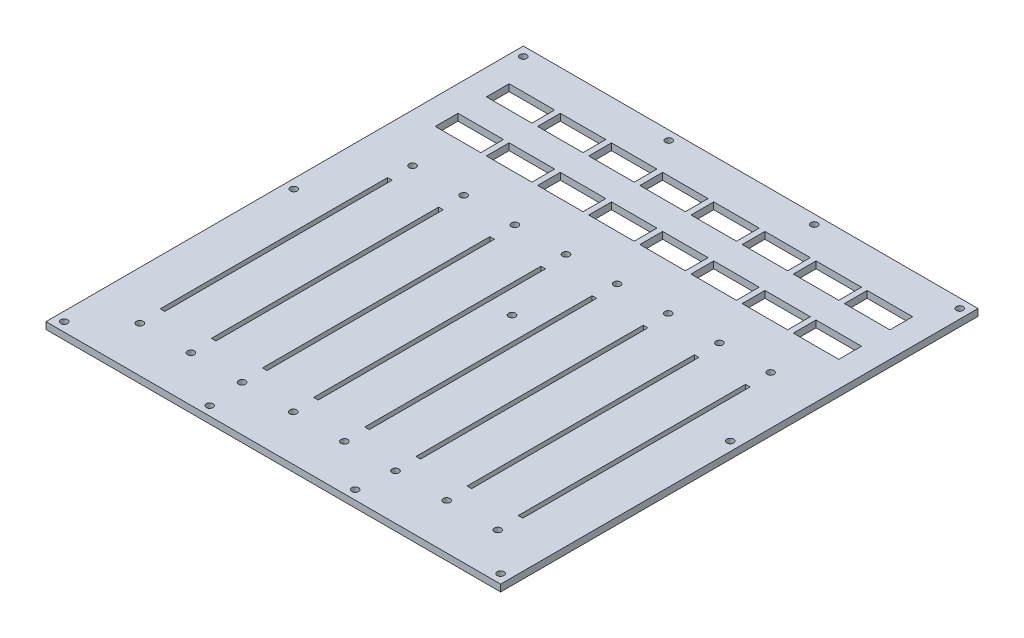
from build123d import *

# Parameters (mm, degrees)
SKETCH1_W                 = 200
SKETCH1_H                 = 210
BOSS_EXTRUDE1_DEPTH       = 3
CUT_EXTRUDE1_REACH        = 147.031
SKETCH2_R                 = 1.5
SKETCH2_W                 = 2
SKETCH2_H                 = 100
LPATTERN1_COUNT           = 8
LPATTERN1_PITCH           = 22.5
CUT_EXTRUDE2_REACH        = 147.031
SKETCH3_W                 = 20
SKETCH3_H                 = 10
LPATTERN2_COUNT           = 8
LPATTERN2_PITCH           = 22.5
LPATTERN2_COUNT_DIR2      = 2
LPATTERN2_PITCH_DIR2      = 22.5
CUT_EXTRUDE3_REACH        = 147.031
SKETCH4_R                 = 1.5
LPATTERN3_COUNT           = 4
LPATTERN3_PITCH           = 64
LPATTERN4_COUNT           = 2
LPATTERN4_PITCH           = 202
LPATTERN4_COPY_1_REACH    = 147.031
LPATTERN4_COPY_1_SKETCH_R = 1.5
LPATTERN4_COPY_2_REACH    = 147.031
LPATTERN4_COPY_2_SKETCH_R = 1.5
LPATTERN4_COPY_3_REACH    = 147.031
LPATTERN4_COPY_3_SKETCH_R = 1.5
CUT_EXTRUDE4_REACH        = 147.031
SKETCH8_R                 = 1.5
CUT_EXTRUDE5_REACH        = 147.031
SKETCH9_R                 = 1.5


with BuildPart() as part:
    # Sketch1 → Boss-Extrude1 (new body)
    with BuildSketch(Plane(origin=(0, 0, 0), x_dir=(1, 0, 0), z_dir=(0, 1, 0))):
        Rectangle(SKETCH1_W, SKETCH1_H)
    extrude(amount=BOSS_EXTRUDE1_DEPTH)

    # Sketch2 → Cut-Extrude1 (cut, up to next)
    with BuildSketch(Plane(origin=(0, 3, 0), x_dir=(1, 0, 0), z_dir=(0, 1, 0)), mode=Mode.PRIVATE) as cut_extrude1_sk1:
        with Locations(Location((-78.75, -85, 0), (0, 0, 270))):
            Circle(SKETCH2_R)
    cut_extrude1_tool1 = extrude(cut_extrude1_sk1.sketch, amount=-CUT_EXTRUDE1_REACH, mode=Mode.PRIVATE) & part.part
    # Sketch2 → Cut-Extrude1 (cut, up to next)
    with BuildSketch(Plane(origin=(0, 3, 0), x_dir=(1, 0, 0), z_dir=(0, 1, 0)), mode=Mode.PRIVATE) as cut_extrude1_sk2:
        with Locations(Location((-78.75, 35, 0), (0, 0, 270))):
            Circle(SKETCH2_R)
    cut_extrude1_tool2 = extrude(cut_extrude1_sk2.sketch, amount=-CUT_EXTRUDE1_REACH, mode=Mode.PRIVATE) & part.part
    # Sketch2 → Cut-Extrude1 (cut, up to next)
    with BuildSketch(Plane(origin=(0, 3, 0), x_dir=(1, 0, 0), z_dir=(0, 1, 0)), mode=Mode.PRIVATE) as cut_extrude1_sk3:
        with Locations((-78.75, -25)):
            Rectangle(SKETCH2_W, SKETCH2_H)
    cut_extrude1_tool3 = extrude(cut_extrude1_sk3.sketch, amount=-CUT_EXTRUDE1_REACH, mode=Mode.PRIVATE) & part.part
    cut_extrude1_1 = cut_extrude1_tool1.solids().sort_by_distance((-78.75, 3, 85))[0]
    add(cut_extrude1_1, mode=Mode.SUBTRACT)
    cut_extrude1_2 = cut_extrude1_tool2.solids().sort_by_distance((-78.75, 3, -35))[0]
    add(cut_extrude1_2, mode=Mode.SUBTRACT)
    cut_extrude1_3 = cut_extrude1_tool3.solids().sort_by_distance((-78.75, 3, 25))[0]
    add(cut_extrude1_3, mode=Mode.SUBTRACT)
    cut_extrude1 = cut_extrude1_1 + cut_extrude1_2 + cut_extrude1_3  # Cut-Extrude1 as one shape, for the pattern or mirror that repeats it

    # LPattern1: Cut-Extrude1 ×8
    with Locations(*[(i * LPATTERN1_PITCH, 0, 0) for i in range(1, LPATTERN1_COUNT)]):
        add(cut_extrude1, mode=Mode.SUBTRACT)

    # Sketch3 → Cut-Extrude2 (cut, up to next)
    with BuildSketch(Plane(origin=(0, 3, 0), x_dir=(1, 0, 0), z_dir=(0, 1, 0)), mode=Mode.PRIVATE) as cut_extrude2_sk1:
        with Locations((-78.75, 60)):
            Rectangle(SKETCH3_W, SKETCH3_H)
    cut_extrude2_tool1 = extrude(cut_extrude2_sk1.sketch, amount=-CUT_EXTRUDE2_REACH, mode=Mode.PRIVATE) & part.part
    cut_extrude2 = cut_extrude2_tool1.solids().sort_by_distance((-78.75, 3, -60))[0]
    add(cut_extrude2, mode=Mode.SUBTRACT)

    # LPattern2: Cut-Extrude2 8 × 2
    with Locations(*[(i * LPATTERN2_PITCH, 0, -j * LPATTERN2_PITCH_DIR2) for i in range(LPATTERN2_COUNT) for j in range(LPATTERN2_COUNT_DIR2) if (i, j) != (0, 0)]):
        add(cut_extrude2, mode=Mode.SUBTRACT)

    # Sketch4 → Cut-Extrude3 (cut, up to next)
    with BuildSketch(Plane(origin=(0, 3, 0), x_dir=(1, 0, 0), z_dir=(0, 1, 0)), mode=Mode.PRIVATE) as cut_extrude3_sk1:
        with Locations(Location((-96, 101, 0), (0, 0, 270))):
            Circle(SKETCH4_R)
    cut_extrude3_tool1 = extrude(cut_extrude3_sk1.sketch, amount=-CUT_EXTRUDE3_REACH, mode=Mode.PRIVATE) & part.part
    cut_extrude3 = cut_extrude3_tool1.solids().sort_by_distance((-96, 3, -101))[0]
    add(cut_extrude3, mode=Mode.SUBTRACT)

    # LPattern3: Cut-Extrude3 ×4
    with Locations(*[(i * LPATTERN3_PITCH, 0, 0) for i in range(1, LPATTERN3_COUNT)]):
        add(cut_extrude3, mode=Mode.SUBTRACT)

    # LPattern4: Cut-Extrude3 ×2
    with Locations(*[(0, 0, i * LPATTERN4_PITCH) for i in range(1, LPATTERN4_COUNT)]):
        add(cut_extrude3, mode=Mode.SUBTRACT)

    # LPattern4 copy 1 sketch → LPattern4 copy 1 (cut, up to next)
    with BuildSketch(Plane(origin=(64, 3, 202), x_dir=(1, 0, 0), z_dir=(0, 1, 0)), mode=Mode.PRIVATE) as lpattern4_copy_1_sk1:
        with Locations(Location((-96, 101, 0), (0, 0, 270))):
            Circle(LPATTERN4_COPY_1_SKETCH_R)
    lpattern4_copy_1_tool1 = extrude(lpattern4_copy_1_sk1.sketch, amount=-LPATTERN4_COPY_1_REACH, mode=Mode.PRIVATE) & part.part
    add(lpattern4_copy_1_tool1.solids().sort_by_distance((-32, 3, 101))[0], mode=Mode.SUBTRACT)

    # LPattern4 copy 2 sketch → LPattern4 copy 2 (cut, up to next)
    with BuildSketch(Plane(origin=(128, 3, 202), x_dir=(1, 0, 0), z_dir=(0, 1, 0)), mode=Mode.PRIVATE) as lpattern4_copy_2_sk1:
        with Locations(Location((-96, 101, 0), (0, 0, 270))):
            Circle(LPATTERN4_COPY_2_SKETCH_R)
    lpattern4_copy_2_tool1 = extrude(lpattern4_copy_2_sk1.sketch, amount=-LPATTERN4_COPY_2_REACH, mode=Mode.PRIVATE) & part.part
    add(lpattern4_copy_2_tool1.solids().sort_by_distance((32, 3, 101))[0], mode=Mode.SUBTRACT)

    # LPattern4 copy 3 sketch → LPattern4 copy 3 (cut, up to next)
    with BuildSketch(Plane(origin=(192, 3, 202), x_dir=(1, 0, 0), z_dir=(0, 1, 0)), mode=Mode.PRIVATE) as lpattern4_copy_3_sk1:
        with Locations(Location((-96, 101, 0), (0, 0, 270))):
            Circle(LPATTERN4_COPY_3_SKETCH_R)
    lpattern4_copy_3_tool1 = extrude(lpattern4_copy_3_sk1.sketch, amount=-LPATTERN4_COPY_3_REACH, mode=Mode.PRIVATE) & part.part
    add(lpattern4_copy_3_tool1.solids().sort_by_distance((96, 3, 101))[0], mode=Mode.SUBTRACT)

    # Sketch8 → Cut-Extrude4 (cut, up to next)
    with BuildSketch(Plane(origin=(0, 3, 0), x_dir=(1, 0, 0), z_dir=(0, 1, 0)), mode=Mode.PRIVATE) as cut_extrude4_sk1:
        with Locations(Location((0, 0, 0), (0, 0, 270))):
            Circle(SKETCH8_R)
    cut_extrude4_tool1 = extrude(cut_extrude4_sk1.sketch, amount=-CUT_EXTRUDE4_REACH, mode=Mode.PRIVATE) & part.part
    add(cut_extrude4_tool1.solids().sort_by_distance((0, 3, 0))[0], mode=Mode.SUBTRACT)

    # Sketch9 → Cut-Extrude5 (cut, up to next)
    with BuildSketch(Plane(origin=(0, 3, 0), x_dir=(1, 0, 0), z_dir=(0, 1, 0)), mode=Mode.PRIVATE) as cut_extrude5_sk1:
        with Locations(Location((-96, 0, 0), (0, 0, 270))):
            Circle(SKETCH9_R)
    cut_extrude5_tool1 = extrude(cut_extrude5_sk1.sketch, amount=-CUT_EXTRUDE5_REACH, mode=Mode.PRIVATE) & part.part
    # Sketch9 → Cut-Extrude5 (cut, up to next)
    with BuildSketch(Plane(origin=(0, 3, 0), x_dir=(1, 0, 0), z_dir=(0, 1, 0)), mode=Mode.PRIVATE) as cut_extrude5_sk2:
        with Locations(Location((96, 0, 0), (0, 0, 270))):
            Circle(SKETCH9_R)
    cut_extrude5_tool2 = extrude(cut_extrude5_sk2.sketch, amount=-CUT_EXTRUDE5_REACH, mode=Mode.PRIVATE) & part.part
    add(cut_extrude5_tool1.solids().sort_by_distance((-96, 3, 0))[0], mode=Mode.SUBTRACT)
    add(cut_extrude5_tool2.solids().sort_by_distance((96, 3, 0))[0], mode=Mode.SUBTRACT)


solid = part.part
